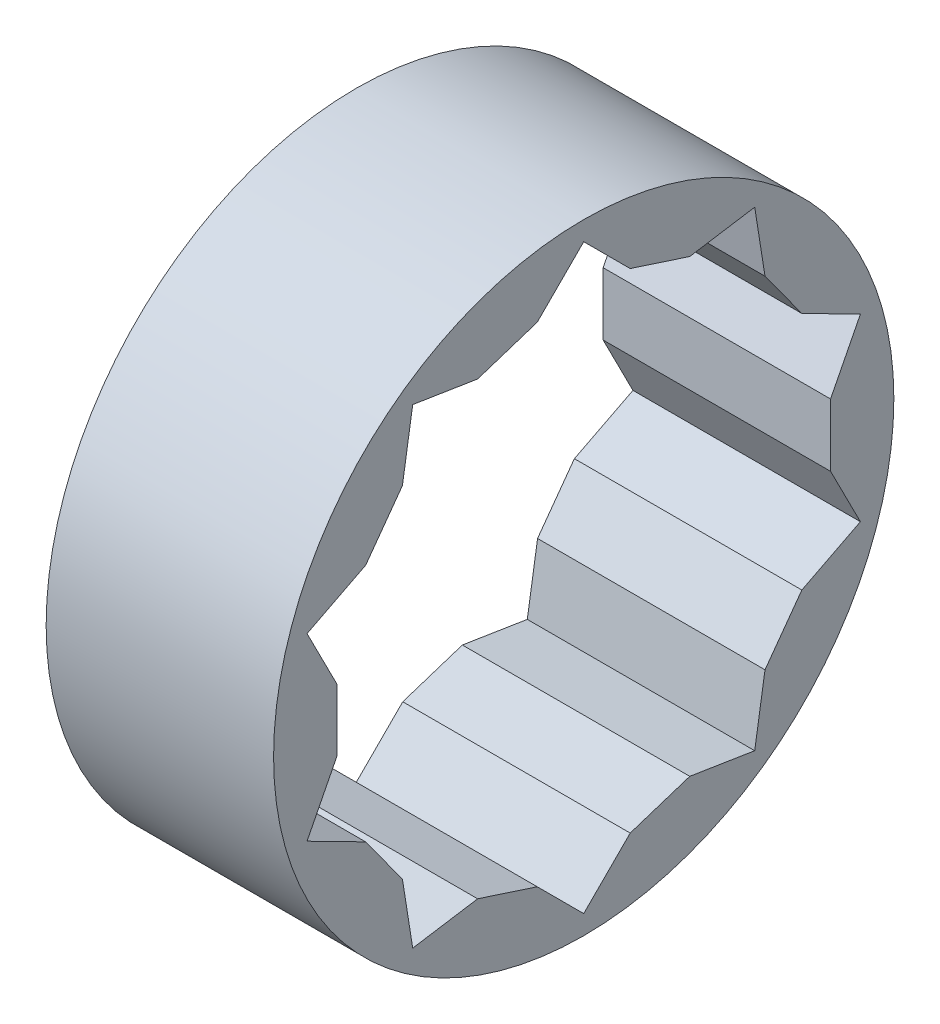
from build123d import *

# Parameters (mm, degrees)
SKETCH1_R           = 30
BOSS_EXTRUDE1_DEPTH = 22


with BuildPart() as part:
    # Sketch1 → Boss-Extrude1 (new body)
    with BuildSketch(Plane(origin=(0, 0, 0), x_dir=(0, 0, -1), z_dir=(1, 0, 0))):
        Circle(SKETCH1_R)
        Polygon((-16.541112452, 22.766888123), (-10.26013758, 21.772079433), (-4.496681536, 23.64473982), (0, 28.141421356), (4.496681536, 23.64473982), (10.26013758, 21.772079433), (16.541112452, 22.766888123), (17.535921141, 16.485913251), (21.09793287, 11.583224708), (26.764082159, 8.696177445), (23.877034895, 3.030028156), (23.877034895, -3.030028156), (26.764082159, -8.696177445), (21.09793287, -11.583224708), (17.535921141, -16.485913251), (16.541112452, -22.766888123), (10.26013758, -21.772079433), (4.496681536, -23.64473982), (0, -28.141421356), (-4.496681536, -23.64473982), (-10.26013758, -21.772079433), (-16.541112452, -22.766888123), (-17.535921141, -16.485913251), (-21.09793287, -11.583224708), (-26.764082159, -8.696177445), (-23.877034895, -3.030028156), (-23.877034895, 3.030028156), (-26.764082159, 8.696177445), (-21.09793287, 11.583224708), (-17.535921141, 16.485913251), align=None, mode=Mode.SUBTRACT)
    extrude(amount=BOSS_EXTRUDE1_DEPTH)


solid = part.part
